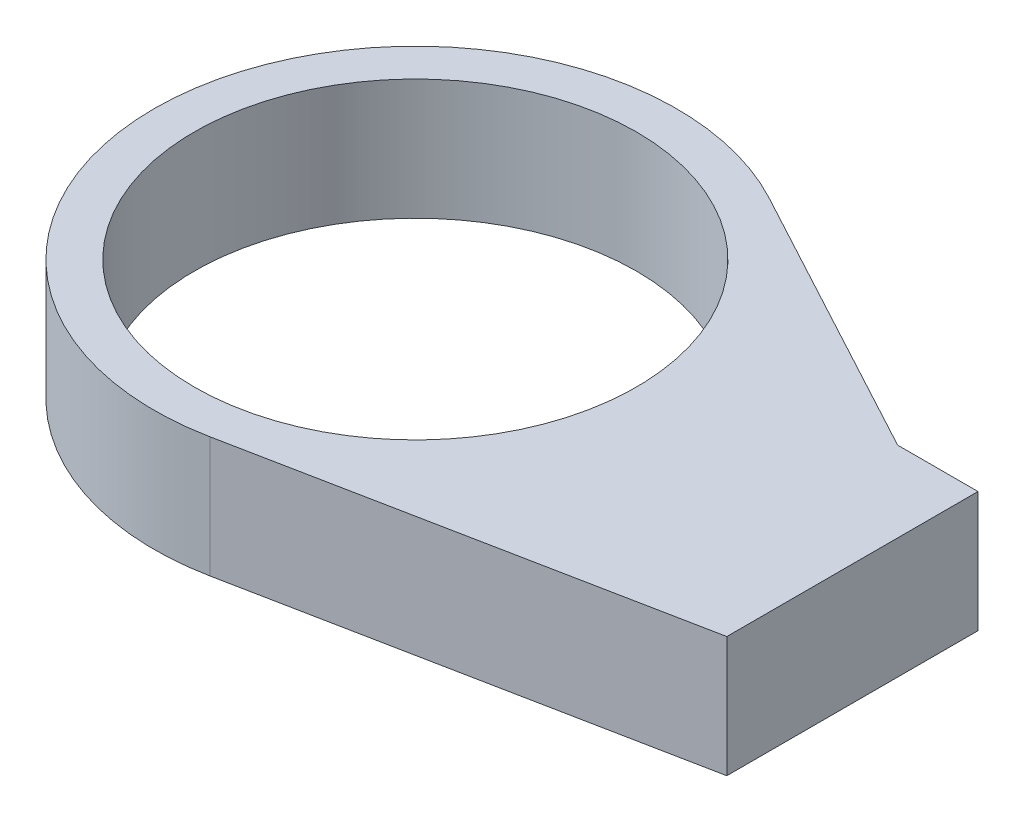
from build123d import *

# Parameters (mm, degrees)
SKETCH1_R           = 22
BOSS_EXTRUDE1_DEPTH = 12


with BuildPart() as part:
    # Sketch1 → Boss-Extrude1 (new body)
    with BuildSketch(Plane(origin=(0, 0, 0), x_dir=(1, 0, 0), z_dir=(0, 1, 0))):
        with BuildLine():
            Line((48, 8), (40, 8))
            Line((40, 8), (12.320941588, 22.895292057))
            ThreePointArc((12.320941588, 22.895292057), (-25.711523254, 3.862327273), (5.050392255, -25.504774809))
            Line((5.050392255, -25.504774809), (48, -17))
            Line((48, -17), (48, 8))
        make_face()
        with Locations(Location((0, 0, 0), (0, 0, 270))):
            Circle(SKETCH1_R, mode=Mode.SUBTRACT)
    extrude(amount=BOSS_EXTRUDE1_DEPTH)


solid = part.part
